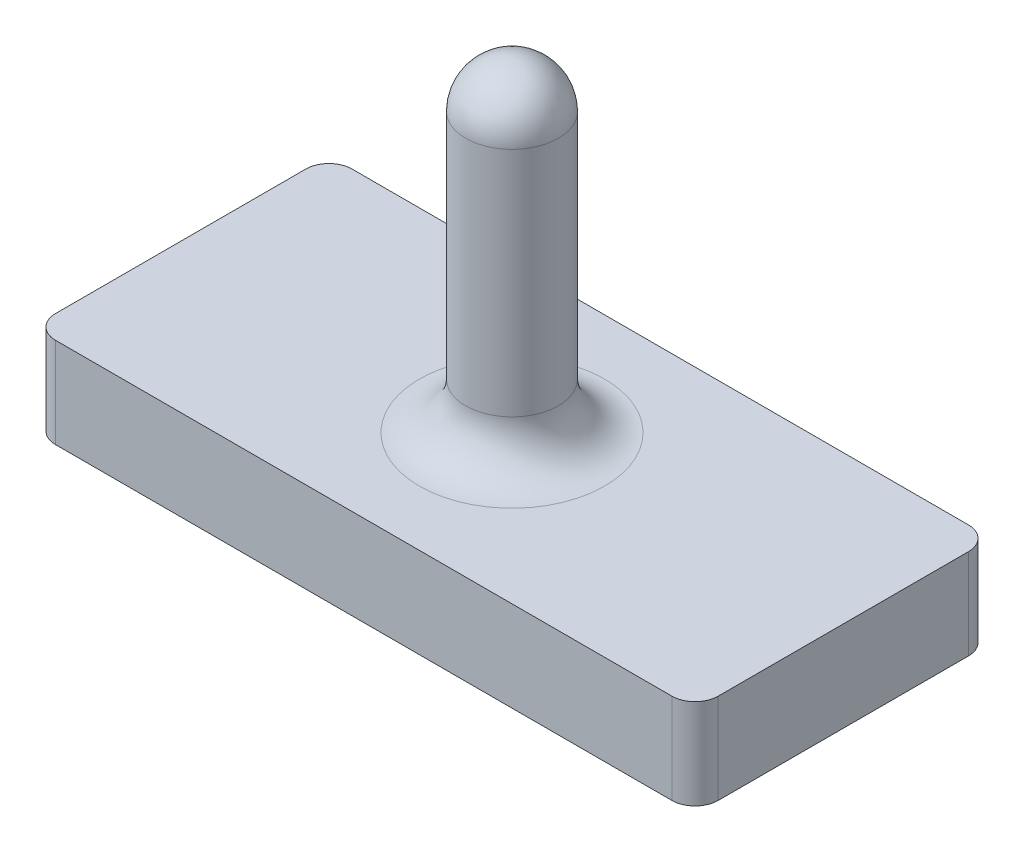
from build123d import *

# Parameters (mm, degrees)
SKETCH1_W           = 36.322
SKETCH1_H           = 16.256
BOSS_EXTRUDE1_DEPTH = 4.953
SKETCH2_R           = 2.54
BOSS_EXTRUDE2_DEPTH = 17.78
FILLET1_R           = 2.54
FILLET2_R           = 2.54
FILLET3_R           = 1.27


with BuildPart() as part:
    # Sketch1 → Boss-Extrude1 (new body)
    with BuildSketch(Plane(origin=(0, 0, 0), x_dir=(1, 0, 0), z_dir=(0, 1, 0))):
        with Locations((18.161, -8.128)):
            Rectangle(SKETCH1_W, SKETCH1_H)
    extrude(amount=BOSS_EXTRUDE1_DEPTH)

    # Sketch2 → Boss-Extrude2 (add)
    with BuildSketch(Plane(origin=(0, 4.953, 0), x_dir=(1, 0, 0), z_dir=(0, 1, 0))):
        with Locations(Location((18.161, -8.128, 0), (0, 0, 270))):
            Circle(SKETCH2_R)
    extrude(amount=BOSS_EXTRUDE2_DEPTH)

    # Fillet1
    fillet1_edges = [part.edges().sort_by_distance(p)[0] for p in [
        (18.161, 22.733, 5.588),
    ]]
    fillet(fillet1_edges, radius=FILLET1_R)

    # Fillet2
    fillet2_edges = [part.edges().sort_by_distance(p)[0] for p in [
        (18.161, 4.953, 5.588),
    ]]
    fillet(fillet2_edges, radius=FILLET2_R)

    # Fillet3
    fillet3_edges = [part.edges().sort_by_distance(p)[0] for p in [
        (0, 2.4765, 0),
        (36.322, 2.4765, 0),
        (36.322, 2.4765, 16.256),
        (0, 2.4765, 16.256),
    ]]
    fillet(fillet3_edges, radius=FILLET3_R)


solid = part.part
